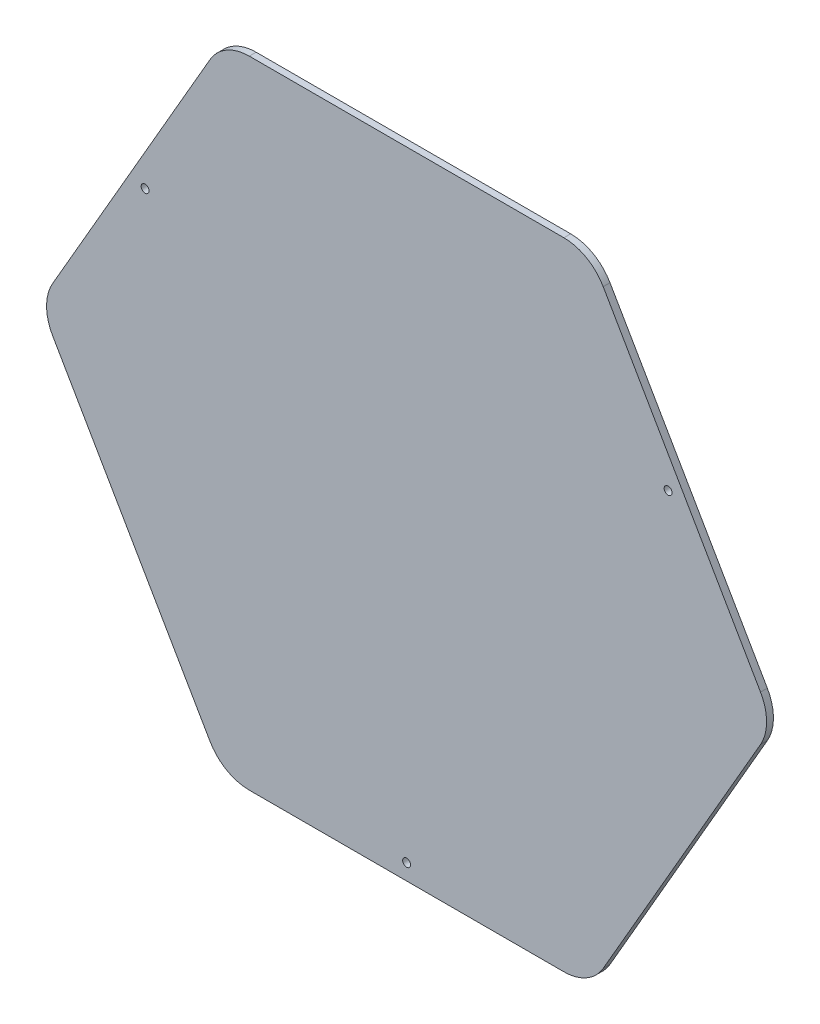
from build123d import *

# Parameters (mm, degrees)
SALIENTE_EXTRUIR1_DEPTH = 3
REDONDEO1_R             = 20
CROQUIS2_R              = 1.75
CORTAR_EXTRUIR1_DEPTH   = 212.545651301


with BuildPart() as part:
    # Croquis1 → Saliente-Extruir1 (new body)
    with BuildSketch(Plane.XY):
        Polygon((-80.829037687, -140), (80.829037687, -140), (161.658075373, 0), (80.829037687, 140), (-80.829037687, 140), (-161.658075373, 0), align=None)
    extrude(amount=SALIENTE_EXTRUIR1_DEPTH)

    # Redondeo1
    redondeo1_edges = [part.edges().sort_by_distance(p)[0] for p in [
        (161.658075373, 0, 1.5),
        (80.829037687, -140, 1.5),
        (-80.829037687, -140, 1.5),
        (-161.658075373, 0, 1.5),
        (-80.829037687, 140, 1.5),
        (80.829037687, 140, 1.5),
    ]]
    fillet(redondeo1_edges, radius=REDONDEO1_R)

    # Croquis2 → Cortar-Extruir1 (cut, through all)
    with BuildSketch(Plane(origin=(0, 0, 0), x_dir=(1, 0, 0), z_dir=(0, 0, -1))):
        with Locations(Location((0, 133, 0), (0, 0, 180))):
            Circle(CROQUIS2_R)
        with Locations(Location((115.181378703, -66.5, 0), (0, 0, 180))):
            Circle(CROQUIS2_R)
        with Locations(Location((-115.181378703, -66.5, 0), (0, 0, 180))):
            Circle(CROQUIS2_R)
    extrude(amount=-CORTAR_EXTRUIR1_DEPTH, mode=Mode.SUBTRACT)


solid = part.part
